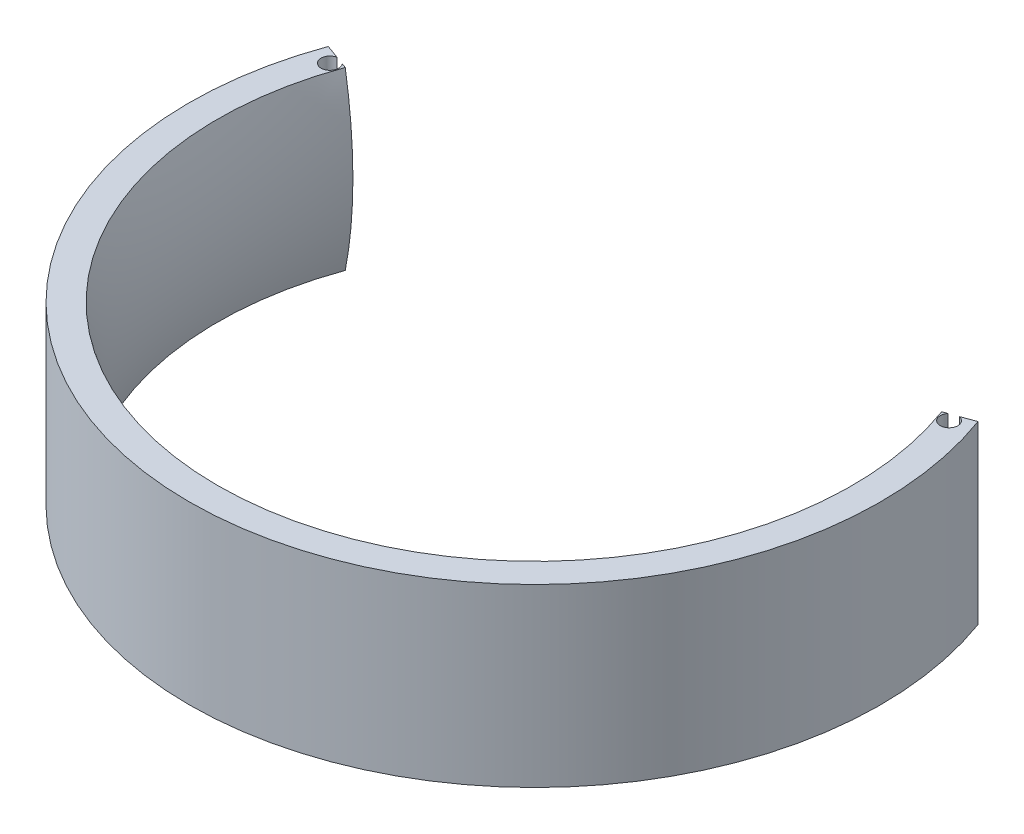
from build123d import *

# Parameters (mm, degrees)
FUNDAMETAL_DIMENSIONS_DEPTH           = 10
FUNDAMETAL_DIMENSIONS_DEPTH_BACK      = 10
ROUND_INSIDE_CUT_ANGLE                = 110
ROUND_INSIDE_CUT_OTHER_WAY_ANGLE      = 110
ROUND_INSIDE_EXTRUDED_ANGLE           = 110
ROUND_INSIDE_EXTRUDED_OTHER_WAY_ANGLE = 110


with BuildPart() as part:
    # Sketch3 → Fundametal Dimensions (new, two sides: drawn at the far end of the back side and taken through both)
    with BuildSketch(Plane(origin=(0, 0, 0), x_dir=(1, 0, 0), z_dir=(0, 1, 0)).offset(-FUNDAMETAL_DIMENSIONS_DEPTH_BACK)):
        with BuildLine():
            Line((-36.955795179, 13.450809429), (-35.392364764, 12.881767294))
            ThreePointArc((-35.392364764, 12.881767294), (-35.560736729, 10.95726692), (-34.452672143, 12.539747151))
            Line((-34.452672143, 12.539747151), (-32.889241728, 11.970705016))
            ThreePointArc((-32.889241728, 11.970705016), (0, -35), (32.889241728, 11.970705016))
            Line((32.889241728, 11.970705016), (34.452672143, 12.539747151))
            ThreePointArc((34.452672143, 12.539747151), (35.560736729, 10.95726692), (35.392364764, 12.881767294))
            Line((35.392364764, 12.881767294), (36.955795179, 13.450809429))
            ThreePointArc((36.955795179, 13.450809429), (0, -39.327535793), (-36.955795179, 13.450809429))
        make_face()
    extrude(amount=FUNDAMETAL_DIMENSIONS_DEPTH + FUNDAMETAL_DIMENSIONS_DEPTH_BACK)

    # Sketch9 → Round Inside Cut (revolve, cut)
    with BuildSketch(Plane(origin=(0, 0, 0), x_dir=(0, 0, -1), z_dir=(1, 0, 0))):
        with BuildLine():
            Line((-36.099996489, 10), (-35, 10))
            Line((-35, 10), (-35, 5))
            ThreePointArc((-35, 5), (-35.45845478, 7.520139498), (-36.099996489, 10))
        make_face()
        with BuildLine():
            Line((-36.099996489, -10), (-35, -10))
            Line((-35, -10), (-35, -5))
            ThreePointArc((-35, -5), (-35.45845478, -7.520139498), (-36.099996489, -10))
        make_face()
    revolve(axis=Axis((0, -20, 0), (0, 1, 0)), revolution_arc=ROUND_INSIDE_CUT_ANGLE, mode=Mode.SUBTRACT)

    # Sketch9 → Round Inside Cut other way (revolve, cut)
    with BuildSketch(Plane(origin=(0, 0, 0), x_dir=(0, 0, -1), z_dir=(1, 0, 0))):
        with BuildLine():
            Line((-36.099996489, 10), (-35, 10))
            Line((-35, 10), (-35, 5))
            ThreePointArc((-35, 5), (-35.45845478, 7.520139498), (-36.099996489, 10))
        make_face()
        with BuildLine():
            Line((-36.099996489, -10), (-35, -10))
            Line((-35, -10), (-35, -5))
            ThreePointArc((-35, -5), (-35.45845478, -7.520139498), (-36.099996489, -10))
        make_face()
    revolve(axis=Axis((0, -20, 0), (0, -1, 0)), revolution_arc=ROUND_INSIDE_CUT_OTHER_WAY_ANGLE, mode=Mode.SUBTRACT)

    # Sketch10 → Round Inside Extruded (revolve)
    with BuildSketch(Plane(origin=(0, 0, 0), x_dir=(0, 0, -1), z_dir=(1, 0, 0))):
        with BuildLine():
            Line((-35, 5), (-35, -5))
            ThreePointArc((-35, -5), (-34.641016151, 0), (-35, 5))
        make_face()
    revolve(axis=Axis((0, -20, 0), (0, 1, 0)), revolution_arc=ROUND_INSIDE_EXTRUDED_ANGLE)

    # Sketch10 → Round Inside Extruded other way (revolve)
    with BuildSketch(Plane(origin=(0, 0, 0), x_dir=(0, 0, -1), z_dir=(1, 0, 0))):
        with BuildLine():
            Line((-35, 5), (-35, -5))
            ThreePointArc((-35, -5), (-34.641016151, 0), (-35, 5))
        make_face()
    revolve(axis=Axis((0, -20, 0), (0, -1, 0)), revolution_arc=ROUND_INSIDE_EXTRUDED_OTHER_WAY_ANGLE)


solid = part.part
